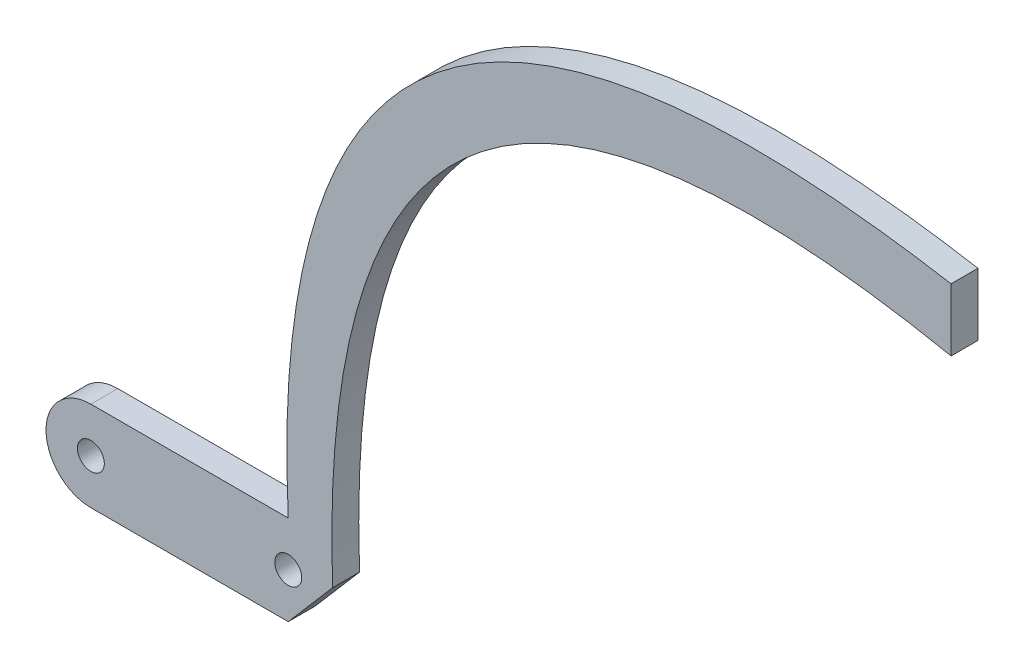
from build123d import *

# Parameters (mm, degrees)
SKETCH1_R           = 1.5
BOSS_EXTRUDE1_DEPTH = 3


with BuildPart() as part:
    # Sketch1 → Boss-Extrude1 (new body)
    with BuildSketch(Plane.XY):
        with BuildLine():
            Line((0, 5), (22, 5))
            add(Edge.make_bspline(
                [(22, 5), (18.375967342, 77.940552932), (95.875501698, 64.550484918)],
                knots=[0, 0, 0, 1, 1, 1], degree=2))
            Line((95.875501698, 64.550484918), (95.875501698, 57.584409058))
            add(Edge.make_bspline(
                [(26.94328985, 0.750923068), (24.379410311, 72.075337148), (95.875501698, 57.584409058)],
                knots=[0, 0, 0, 1, 1, 1], degree=2))
            Line((26.94328985, 0.750923068), (22, -5))
            Line((22, -5), (0, -5))
            ThreePointArc((0, -5), (-5, 0), (0, 5))
        make_face()
        Circle(SKETCH1_R, mode=Mode.SUBTRACT)
        with Locations((22, 0)):
            Circle(SKETCH1_R, mode=Mode.SUBTRACT)
    extrude(amount=BOSS_EXTRUDE1_DEPTH)


solid = part.part
